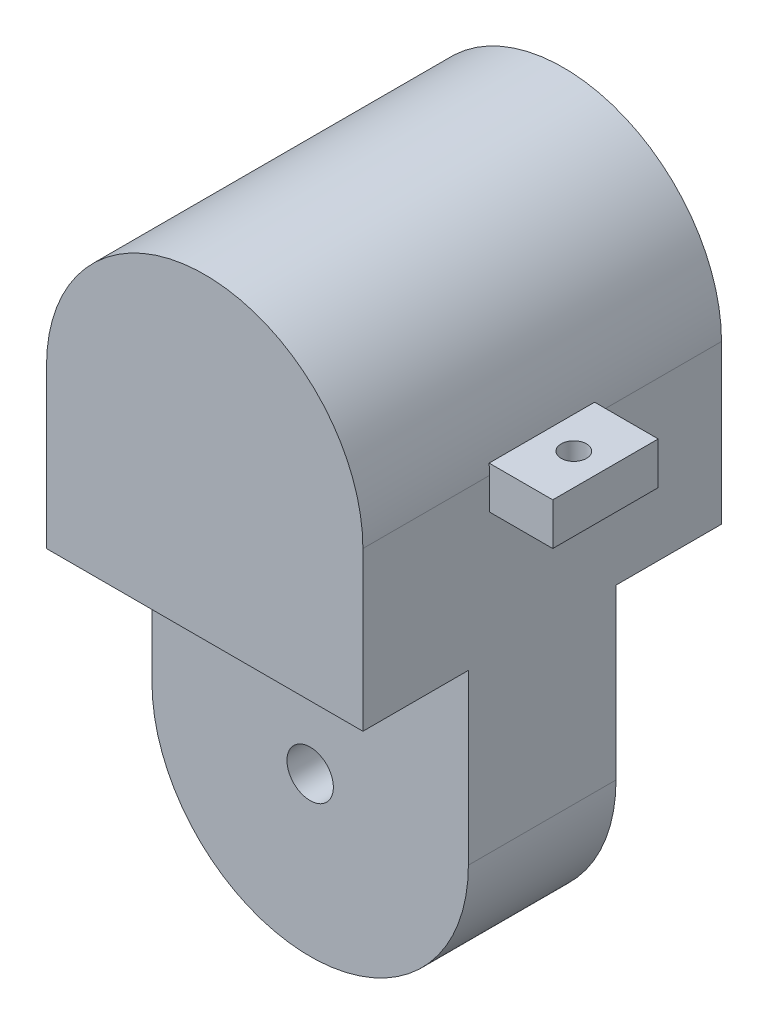
from build123d import *

# Parameters (mm, degrees)
LINK1_BODY_DEPTH       = 8.5
TONGUE_CUT_DEPTH       = 29.744564704
TONGUE_CUT_DEPTH_BACK  = 29.744564704
SKETCH1_W              = 5.5
SKETCH1_H              = 15.998130079
PIN_HOLES_DEPTH        = 26.64176281
PIN_HOLES_DEPTH_BACK   = 26.64176281
SKETCH3_R              = 1.1
SKETCH4_W              = 3.5
SKETCH4_H              = 2
GUIDE_BLOCK_1_DEPTH    = 2.5
CORD_GUIDES_DEPTH      = 27.673957337
CORD_GUIDES_DEPTH_BACK = 27.673957337
SKETCH6_R              = 0.6


with BuildPart() as part:
    # Link1_Outline → Link1_Body (new, symmetric)
    with BuildSketch(Plane.XY):
        with BuildLine():
            Line((-7.5, 0), (-7.5, 15.5))
            ThreePointArc((-7.5, 15.5), (0, 23), (7.5, 15.5))
            Line((7.5, 15.5), (7.5, 0))
            ThreePointArc((7.5, 0), (0, -7.5), (-7.5, 0))
        make_face()
    extrude(amount=LINK1_BODY_DEPTH, both=True)

    # Sketch1 → Tongue_Cut (cut, two sides: drawn at the far end of the back side and taken through both)
    with BuildSketch(Plane(origin=(7.5, 0, 0), x_dir=(0, 0, -1), z_dir=(1, 0, 0)).offset(-TONGUE_CUT_DEPTH_BACK)):
        with Locations((6.25, -0.00093496)):
            Rectangle(SKETCH1_W, SKETCH1_H)
        with Locations((-6.25, -0.00093496)):
            Rectangle(SKETCH1_W, SKETCH1_H)
    extrude(amount=TONGUE_CUT_DEPTH + TONGUE_CUT_DEPTH_BACK, mode=Mode.SUBTRACT)

    # Sketch3 → Pin_Holes (cut, two sides: drawn at the far end of the back side and taken through both)
    with BuildSketch(Plane.XY.offset(-PIN_HOLES_DEPTH_BACK)):
        Circle(SKETCH3_R)
    extrude(amount=PIN_HOLES_DEPTH + PIN_HOLES_DEPTH_BACK, mode=Mode.SUBTRACT)

    # Sketch4 → Guide_Block_1 (add, symmetric)
    with BuildSketch(Plane.XY):
        with Locations((8.75, 15)):
            Rectangle(SKETCH4_W, SKETCH4_H)
    extrude(amount=GUIDE_BLOCK_1_DEPTH, both=True)

    # Sketch6 → Cord_Guides (cut, two sides: drawn at the far end of the back side and taken through both)
    with BuildSketch(Plane(origin=(0, 0, 0), x_dir=(1, 0, 0), z_dir=(0, 1, 0)).offset(-CORD_GUIDES_DEPTH_BACK)):
        with Locations(Location((9, 0, 0), (0, 0, 90))):
            Circle(SKETCH6_R)
    extrude(amount=CORD_GUIDES_DEPTH + CORD_GUIDES_DEPTH_BACK, mode=Mode.SUBTRACT)


solid = part.part
